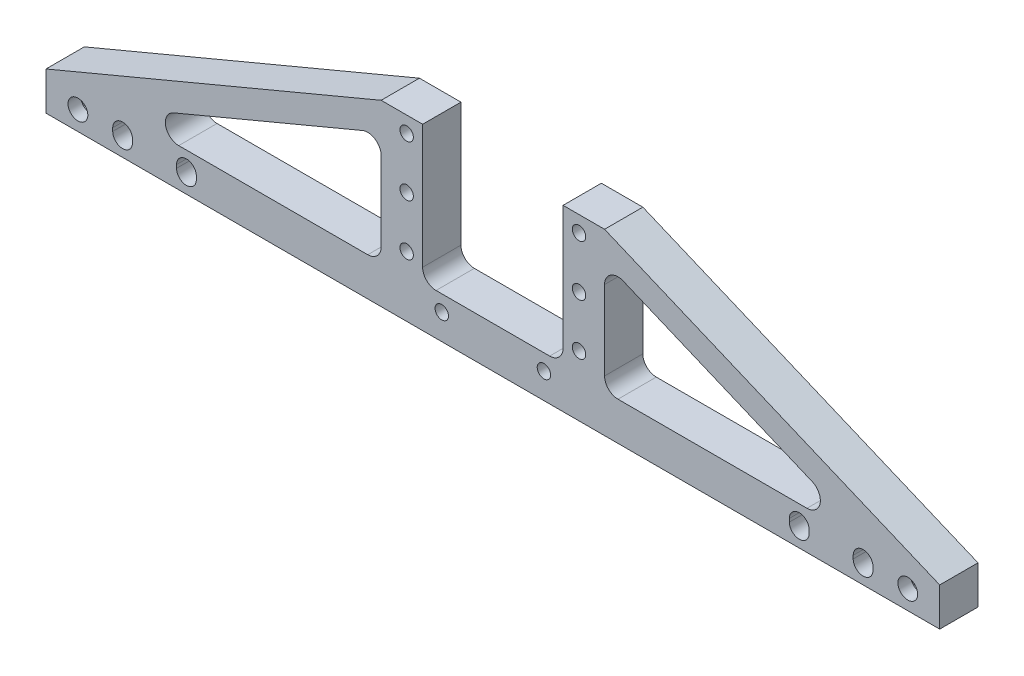
from build123d import *

# Parameters (mm, degrees)
SKETCH_1_R          = 1.05
SKETCH_1_R_2        = 1.55
EXTRUDE_1_DEPTH     = 6
SKETCH_2_R          = 1.55
CUT_EXTRUDE_1_DEPTH = 3
CUT_EXTRUDE_2_DEPTH = 75.242844773
CUT_EXTRUDE_3_DEPTH = 4
SKETCH_6_R          = 1.9
CUT_EXTRUDE_4_DEPTH = 3
SKETCH_7_W          = 6
SKETCH_7_H          = 0.01
EXTRUDE_2_DEPTH     = 4


with BuildPart() as part:
    # ｽｹｯﾁ1 → ﾎﾞｽ - 押し出し1 (new body)
    with BuildSketch(Plane.XY):
        with BuildLine():
            Line((-11, 4.6), (-11, 24))
            Line((-11, 24), (-17.5, 24))
            Line((-17.5, 24), (-70, 2))
            Line((-70, 2), (-70, -4))
            Line((-70, -4), (-17.5, -4))
            Line((-17.5, -4), (17.5, -4))
            Line((17.5, -4), (70, -4))
            Line((70, -4), (70, 2))
            Line((70, 2), (17.5, 24))
            Line((17.5, 24), (11, 24))
            Line((11, 24), (11, 4.6))
            ThreePointArc((11, 4.6), (10.38492424, 3.11507576), (8.9, 2.5))
            Line((8.9, 2.5), (-8.9, 2.5))
            ThreePointArc((-8.9, 2.5), (-10.38492424, 3.11507576), (-11, 4.6))
        make_face()
        with Locations((-13.5, 5.5)):
            Circle(SKETCH_1_R, mode=Mode.SUBTRACT)
        with Locations((-8, 0)):
            Circle(SKETCH_1_R, mode=Mode.SUBTRACT)
        with Locations((8, 0)):
            Circle(SKETCH_1_R, mode=Mode.SUBTRACT)
        with Locations((-13.5, 13.5)):
            Circle(SKETCH_1_R, mode=Mode.SUBTRACT)
        with Locations((-13.5, 21.5)):
            Circle(SKETCH_1_R, mode=Mode.SUBTRACT)
        with Locations((13.5, 21.5)):
            Circle(SKETCH_1_R, mode=Mode.SUBTRACT)
        with Locations((13.5, 13.5)):
            Circle(SKETCH_1_R, mode=Mode.SUBTRACT)
        with Locations((13.5, 5.5)):
            Circle(SKETCH_1_R, mode=Mode.SUBTRACT)
        with Locations((-65, -1)):
            Circle(SKETCH_1_R_2, mode=Mode.SUBTRACT)
        with Locations(Location((65, -1, 0), (0, 0, 180))):
            Circle(SKETCH_1_R_2, mode=Mode.SUBTRACT)
        with BuildLine():
            Line((-17.5, 4.1), (-17.5, 16.506066998))
            ThreePointArc((-17.5, 16.506066998), (-18.436901101, 18.254552329), (-20.411619954, 18.442887344))
            Line((-20.411619954, 18.442887344), (-50.017007109, 6.036820345))
            ThreePointArc((-50.017007109, 6.036820345), (-51.264188108, 3.686069284), (-49.205387155, 2))
            Line((-49.205387155, 2), (-19.6, 2))
            ThreePointArc((-19.6, 2), (-18.11507576, 2.61507576), (-17.5, 4.1))
        make_face(mode=Mode.SUBTRACT)
        with BuildLine():
            Line((20.411619954, 18.442887344), (50.017007109, 6.036820345))
            ThreePointArc((50.017007109, 6.036820345), (51.264188108, 3.686069284), (49.205387155, 2))
            Line((49.205387155, 2), (19.6, 2))
            ThreePointArc((19.6, 2), (18.11507576, 2.61507576), (17.5, 4.1))
            Line((17.5, 4.1), (17.5, 16.506066998))
            ThreePointArc((17.5, 16.506066998), (18.436901101, 18.254552329), (20.411619954, 18.442887344))
        make_face(mode=Mode.SUBTRACT)
    extrude(amount=EXTRUDE_1_DEPTH)

    # ｽｹｯﾁ2 → ｶｯﾄ - 押し出し1 (cut)
    with BuildSketch(Plane.XY.offset(6)):
        with Locations((-48, -1)):
            Circle(SKETCH_2_R)
        with Locations(Location((48, -1, 0), (0, 0, 180))):
            Circle(SKETCH_2_R)
        with Locations((-58, -1)):
            Circle(SKETCH_2_R)
        with Locations(Location((58, -1, 0), (0, 0, 180))):
            Circle(SKETCH_2_R)
    extrude(amount=-CUT_EXTRUDE_1_DEPTH, mode=Mode.SUBTRACT)

    # ｽｹｯﾁ3 → ｶｯﾄ - 押し出し2 (cut, through all)
    with BuildSketch(Plane(origin=(0, 0, 0), x_dir=(-1, 0, 0), z_dir=(0, 0, -1))):
        with BuildLine():
            Line((-56.45, -0.75), (-56.45, -1.25))
            ThreePointArc((-56.45, -1.25), (-58, -2.8), (-59.55, -1.25))
            Line((-59.55, -1.25), (-59.55, -0.75))
            ThreePointArc((-59.55, -0.75), (-58, 0.8), (-56.45, -0.75))
        make_face()
        with BuildLine():
            Line((-46.45, -0.75), (-46.45, -1.25))
            ThreePointArc((-46.45, -1.25), (-48, -2.8), (-49.55, -1.25))
            Line((-49.55, -1.25), (-49.55, -0.75))
            ThreePointArc((-49.55, -0.75), (-48, 0.8), (-46.45, -0.75))
        make_face()
        with BuildLine():
            Line((56.45, -0.75), (56.45, -1.25))
            ThreePointArc((56.45, -1.25), (58, -2.8), (59.55, -1.25))
            Line((59.55, -1.25), (59.55, -0.75))
            ThreePointArc((59.55, -0.75), (58, 0.8), (56.45, -0.75))
        make_face()
        with BuildLine():
            Line((46.45, -0.75), (46.45, -1.25))
            ThreePointArc((46.45, -1.25), (48, -2.8), (49.55, -1.25))
            Line((49.55, -1.25), (49.55, -0.75))
            ThreePointArc((49.55, -0.75), (48, 0.8), (46.45, -0.75))
        make_face()
    extrude(amount=-CUT_EXTRUDE_2_DEPTH, mode=Mode.SUBTRACT)

    # ｽｹｯﾁ4 → ｶｯﾄ - 押し出し3 (cut)
    with BuildSketch(Plane(origin=(0, 0, 0), x_dir=(-1, 0, 0), z_dir=(0, 0, -1))):
        with BuildLine():
            Line((-68, -1), (-68, -4))
            Line((-68, -4), (-62, -4))
            Line((-62, -4), (-62, -1))
            ThreePointArc((-62, -1), (-65, 2), (-68, -1))
        make_face()
        with BuildLine():
            Line((62, -4), (62, -1))
            ThreePointArc((62, -1), (65, 2), (68, -1))
            Line((68, -1), (68, -4))
            Line((68, -4), (62, -4))
        make_face()
    extrude(amount=-CUT_EXTRUDE_3_DEPTH, mode=Mode.SUBTRACT)

    # ｽｹｯﾁ6 → ｶｯﾄ - 押し出し4 (cut)
    with BuildSketch(Plane(origin=(0, 0, 0), x_dir=(-1, 0, 0), z_dir=(0, 0, -1))):
        with Locations((-13.5, 21.5)):
            Circle(SKETCH_6_R)
        with Locations((-13.5, 13.5)):
            Circle(SKETCH_6_R)
        with Locations((-13.5, 5.5)):
            Circle(SKETCH_6_R)
        with Locations((-8, 0)):
            Circle(SKETCH_6_R)
        with Locations(Location((8, 0, 0), (0, 0, 180))):
            Circle(SKETCH_6_R)
        with Locations(Location((13.5, 5.5, 0), (0, 0, 180))):
            Circle(SKETCH_6_R)
        with Locations(Location((13.5, 13.5, 0), (0, 0, 180))):
            Circle(SKETCH_6_R)
        with Locations(Location((13.5, 21.5, 0), (0, 0, 180))):
            Circle(SKETCH_6_R)
    extrude(amount=-CUT_EXTRUDE_4_DEPTH, mode=Mode.SUBTRACT)

    # ｽｹｯﾁ7 → ﾎﾞｽ - 押し出し2 (add)
    with BuildSketch(Plane(origin=(0, 0, 4), x_dir=(-1, 0, 0), z_dir=(0, 0, -1))):
        with Locations((65, -3.995)):
            Rectangle(SKETCH_7_W, SKETCH_7_H)
        with Locations((-65, -3.995)):
            Rectangle(SKETCH_7_W, SKETCH_7_H)
    extrude(amount=EXTRUDE_2_DEPTH)


solid = part.part
